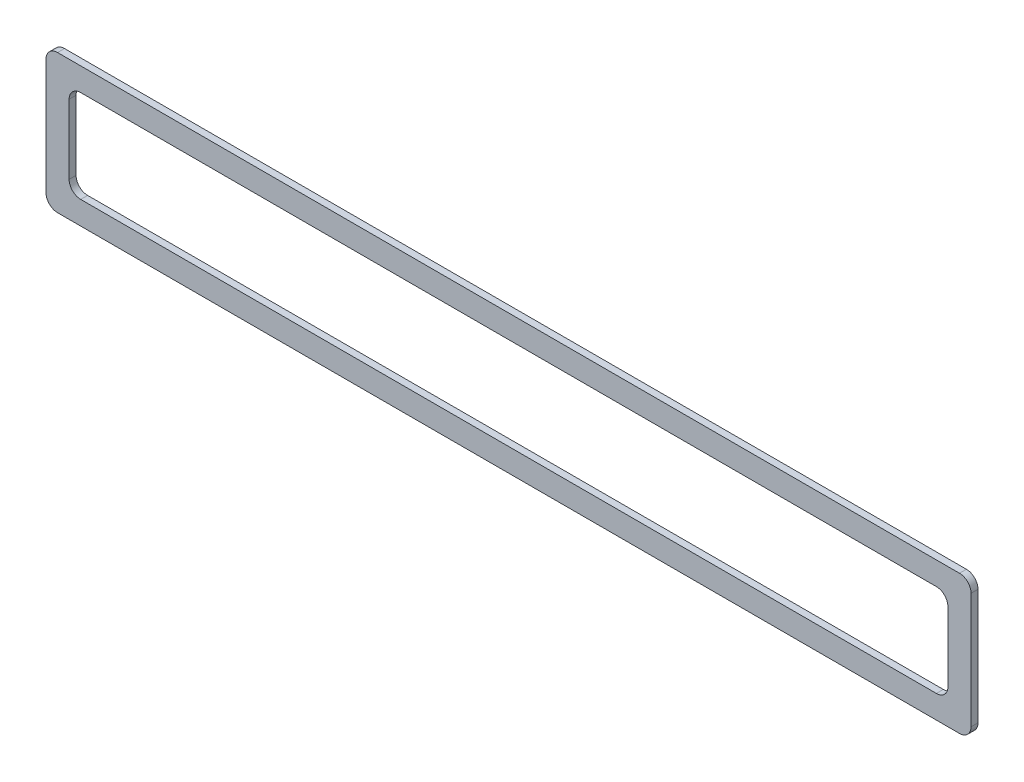
from build123d import *

# Parameters (mm, degrees)
EXTRUDE1_DEPTH = 3


with BuildPart() as part:
    # Sketch1 → Extrude1 (new body)
    with BuildSketch(Plane.XY):
        with BuildLine():
            Line((-195, -30), (195, -30))
            ThreePointArc((195, -30), (198.535533906, -28.535533906), (200, -25))
            Line((200, -25), (200, 25))
            ThreePointArc((200, 25), (198.535533906, 28.535533906), (195, 30))
            Line((195, 30), (-195, 30))
            ThreePointArc((-195, 30), (-198.535533906, 28.535533906), (-200, 25))
            Line((-200, 25), (-200, -25))
            ThreePointArc((-200, -25), (-198.535533906, -28.535533906), (-195, -30))
        make_face()
        with BuildLine():
            Line((-185, -20), (185, -20))
            ThreePointArc((185, -20), (188.535533906, -18.535533906), (190, -15))
            Line((190, -15), (190, 15))
            ThreePointArc((190, 15), (188.535533906, 18.535533906), (185, 20))
            Line((185, 20), (-185, 20))
            ThreePointArc((-185, 20), (-188.535533906, 18.535533906), (-190, 15))
            Line((-190, 15), (-190, -15))
            ThreePointArc((-190, -15), (-188.535533906, -18.535533906), (-185, -20))
        make_face(mode=Mode.SUBTRACT)
    extrude(amount=EXTRUDE1_DEPTH)


solid = part.part
